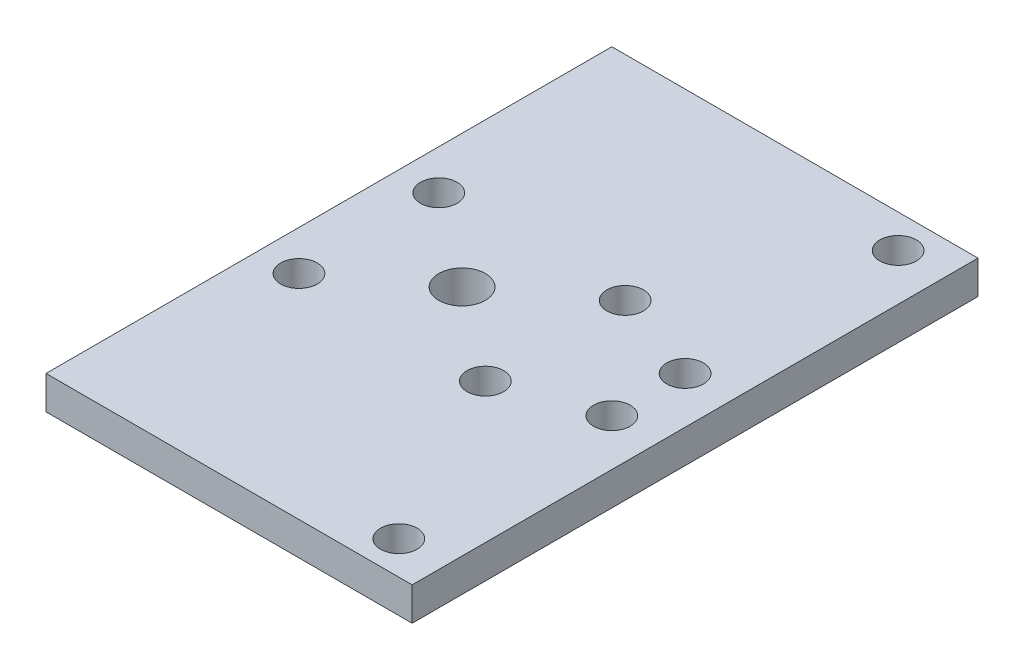
from build123d import *

# Parameters (mm, degrees)
SKETCH1_W           = 55
SKETCH1_H           = 85
SKETCH1_R           = 2.75
SKETCH1_R_2         = 3.5
BOSS_EXTRUDE1_DEPTH = 5


with BuildPart() as part:
    # Sketch1 → Boss-Extrude1 (new body)
    with BuildSketch(Plane.XZ):
        with Locations((7.5, 0)):
            Rectangle(SKETCH1_W, SKETCH1_H)
        with Locations(Location((14, 10.5, 0), (0, 0, 90))):
            Circle(SKETCH1_R, mode=Mode.SUBTRACT)
        with Locations(Location((-14, 10.5, 0), (0, 0, 90))):
            Circle(SKETCH1_R, mode=Mode.SUBTRACT)
        with Locations(Location((-14, -10.5, 0), (0, 0, 90))):
            Circle(SKETCH1_R, mode=Mode.SUBTRACT)
        with Locations(Location((14, -10.5, 0), (0, 0, 90))):
            Circle(SKETCH1_R, mode=Mode.SUBTRACT)
        with Locations(Location((28, 37.5, 0), (0, 0, 90))):
            Circle(SKETCH1_R, mode=Mode.SUBTRACT)
        with Locations(Location((28, 5.5, 0), (0, 0, 90))):
            Circle(SKETCH1_R, mode=Mode.SUBTRACT)
        with Locations(Location((28, -5.5, 0), (0, 0, 90))):
            Circle(SKETCH1_R, mode=Mode.SUBTRACT)
        with Locations(Location((28, -37.5, 0), (0, 0, 90))):
            Circle(SKETCH1_R, mode=Mode.SUBTRACT)
        with Locations(Location((0, 0, 0), (0, 0, 90))):
            Circle(SKETCH1_R_2, mode=Mode.SUBTRACT)
    extrude(amount=-BOSS_EXTRUDE1_DEPTH)


solid = part.part
